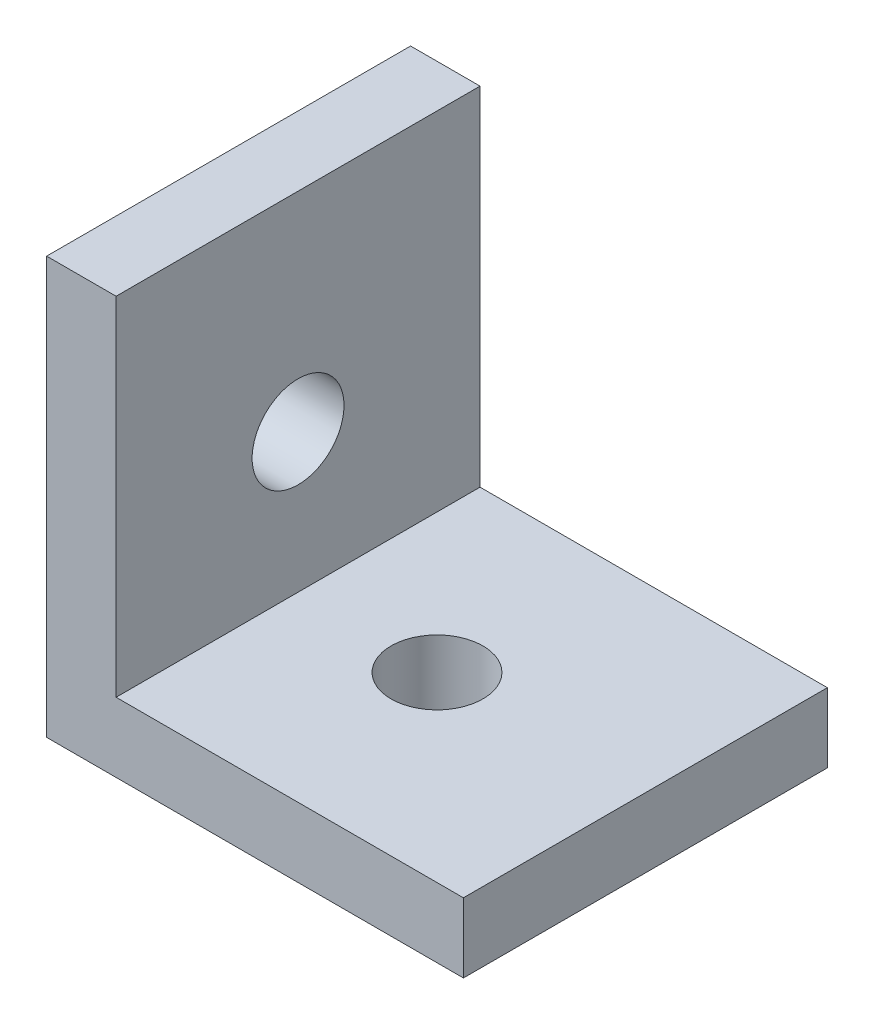
from build123d import *

# Parameters (mm, degrees)
BODY_DEPTH   = 33.27
SKETCH2_R    = 4.2
HOLESX_DEPTH = 6.35
SKETCH3_R    = 4.2
HOLESY_DEPTH = 6.35


with BuildPart() as part:
    # Sketch1 → Body (new body)
    with BuildSketch(Plane.XY.offset(-16.635)):
        Polygon((0, 0), (38.1, 0), (38.1, 6.35), (6.35, 6.35), (6.35, 38.1), (0, 38.1), align=None)
    extrude(amount=BODY_DEPTH)

    # Sketch2 → HolesX (cut)
    with BuildSketch(Plane(origin=(0, 6.35, 0), x_dir=(1, 0, 0), z_dir=(0, 1, 0))):
        with Locations(Location((19.05, 0, 0), (0, 0, 270))):
            Circle(SKETCH2_R)
    extrude(amount=-HOLESX_DEPTH, mode=Mode.SUBTRACT)

    # Sketch3 → HolesY (cut)
    with BuildSketch(Plane(origin=(6.35, 0, 0), x_dir=(0, 0, -1), z_dir=(1, 0, 0))):
        with Locations((0, 19.05)):
            Circle(SKETCH3_R)
    extrude(amount=-HOLESY_DEPTH, mode=Mode.SUBTRACT)


solid = part.part
